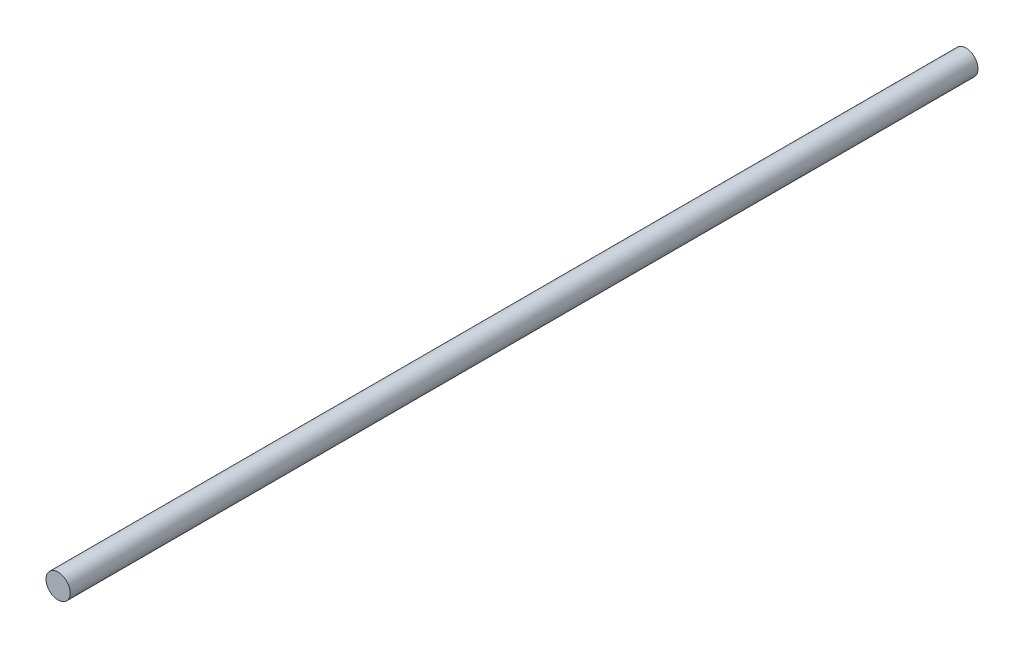
from build123d import *

# Parameters (mm, degrees)
SKETCH1_R           = 16.25
BOSS_EXTRUDE1_DEPTH = 1219.2


with BuildPart() as part:
    # Sketch1 → Boss-Extrude1 (new body)
    with BuildSketch(Plane.XY):
        with Locations(Location((0, 0, 0), (0, 0, 180))):
            Circle(SKETCH1_R)
    extrude(amount=BOSS_EXTRUDE1_DEPTH)


solid = part.part
